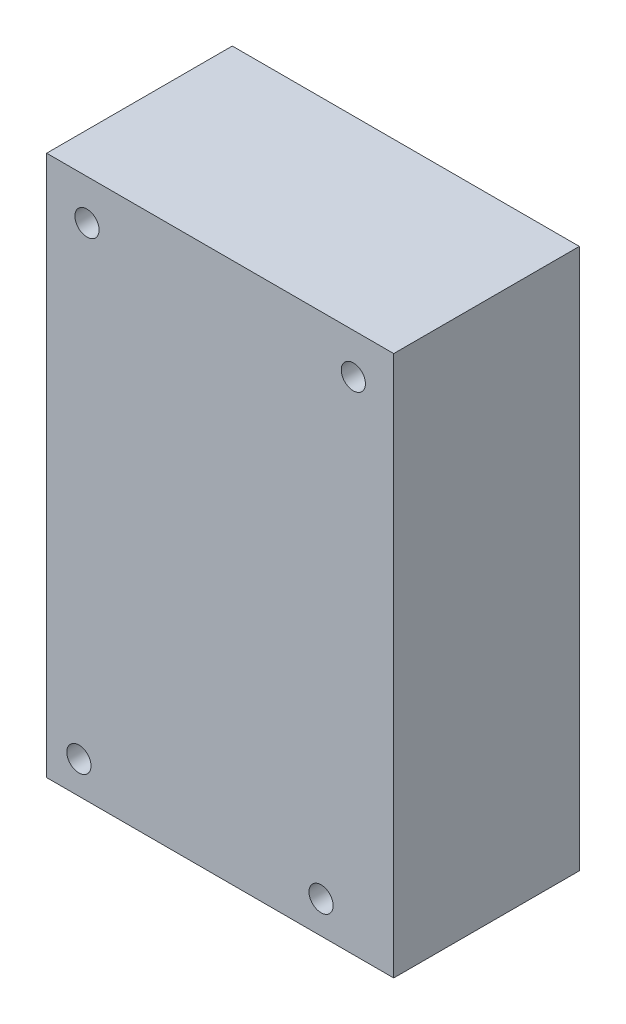
from build123d import *

# Parameters (mm, degrees)
SKETCH1_W           = 67
SKETCH1_H           = 43
BOSS_EXTRUDE1_DEPTH = 23
CUT_EXTRUDE1_REACH  = 47.973
SKETCH2_R           = 1.5


with BuildPart() as part:
    # Sketch1 → Boss-Extrude1 (new body)
    with BuildSketch(Plane(origin=(0, 0, 0), x_dir=(0, 1, 0), z_dir=(0, 0, 1))):
        Rectangle(SKETCH1_W, SKETCH1_H)
    extrude(amount=BOSS_EXTRUDE1_DEPTH)

    # Sketch2 → Cut-Extrude1 (cut, up to next)
    with BuildSketch(Plane.XY.offset(23), mode=Mode.PRIVATE) as cut_extrude1_sk1:
        with Locations((-16.5, 28.5)):
            Circle(SKETCH2_R)
    cut_extrude1_tool1 = extrude(cut_extrude1_sk1.sketch, amount=-CUT_EXTRUDE1_REACH, mode=Mode.PRIVATE) & part.part
    # Sketch2 → Cut-Extrude1 (cut, up to next)
    with BuildSketch(Plane.XY.offset(23), mode=Mode.PRIVATE) as cut_extrude1_sk2:
        with Locations((16.5, 28.5)):
            Circle(SKETCH2_R)
    cut_extrude1_tool2 = extrude(cut_extrude1_sk2.sketch, amount=-CUT_EXTRUDE1_REACH, mode=Mode.PRIVATE) & part.part
    # Sketch2 → Cut-Extrude1 (cut, up to next)
    with BuildSketch(Plane.XY.offset(23), mode=Mode.PRIVATE) as cut_extrude1_sk3:
        with Locations((12.5, -29.5)):
            Circle(SKETCH2_R)
    cut_extrude1_tool3 = extrude(cut_extrude1_sk3.sketch, amount=-CUT_EXTRUDE1_REACH, mode=Mode.PRIVATE) & part.part
    # Sketch2 → Cut-Extrude1 (cut, up to next)
    with BuildSketch(Plane.XY.offset(23), mode=Mode.PRIVATE) as cut_extrude1_sk4:
        with Locations((-17.5, -29.5)):
            Circle(SKETCH2_R)
    cut_extrude1_tool4 = extrude(cut_extrude1_sk4.sketch, amount=-CUT_EXTRUDE1_REACH, mode=Mode.PRIVATE) & part.part
    add(cut_extrude1_tool1.solids().sort_by_distance((-16.5, 28.5, 23))[0], mode=Mode.SUBTRACT)
    add(cut_extrude1_tool2.solids().sort_by_distance((16.5, 28.5, 23))[0], mode=Mode.SUBTRACT)
    add(cut_extrude1_tool3.solids().sort_by_distance((12.5, -29.5, 23))[0], mode=Mode.SUBTRACT)
    add(cut_extrude1_tool4.solids().sort_by_distance((-17.5, -29.5, 23))[0], mode=Mode.SUBTRACT)


solid = part.part
